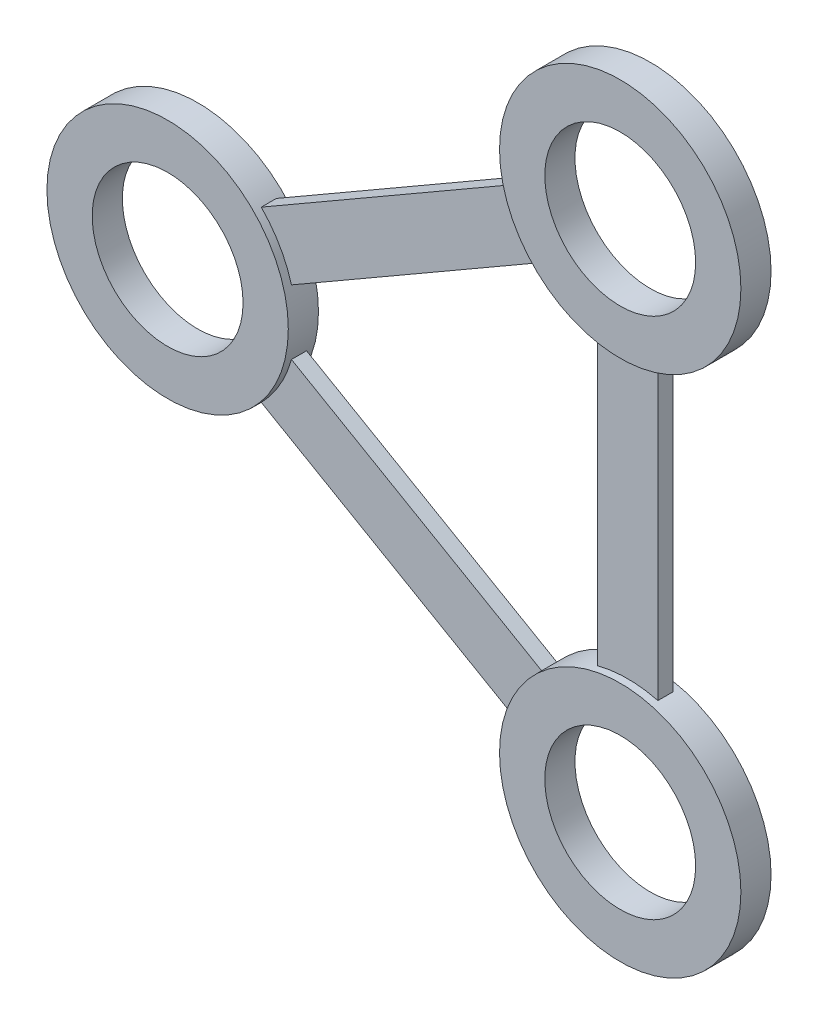
from build123d import *

# Parameters (mm, degrees)
BOSS_EXTRUDE1_DEPTH   = 2.5
BOSS_EXTRUDE1_2_DEPTH = 2.5
BOSS_EXTRUDE1_3_DEPTH = 2.5
SKETCH1_3_R           = 40
SKETCH1_3_R_2         = 25
BOSS_EXTRUDE2_DEPTH   = 5


with BuildPart() as part:
    # Sketch1 → Boss-Extrude1 (new, symmetric)
    with BuildSketch(Plane.XY):
        with BuildLine():
            ThreePointArc((80.86569638, 47.872706916), (70.86569638, 46.602540378), (60.86569638, 47.872706916))
            Line((60.86569638, 47.872706916), (60.86569638, -47.870166538))
            ThreePointArc((60.86569638, -47.870166538), (70.86569638, -46.6), (80.86569638, -47.870166538))
            Line((80.86569638, -47.870166538), (80.86569638, 47.872706916))
        make_face()
    extrude(amount=BOSS_EXTRUDE1_DEPTH, both=True)



with BuildPart() as body_2:
    # Sketch1 → Boss-Extrude1 2 (new, symmetric)
    with BuildSketch(Plane.XY):
        with BuildLine():
            Line((-40.593283957, 10.704662693), (42.324676718, 58.57736961))
            ThreePointArc((42.324676718, 58.57736961), (36.224680229, 66.602540378), (32.324676718, 75.897877685))
            Line((32.324676718, 75.897877685), (-50.593283957, 28.025170769))
            ThreePointArc((-50.593283957, 28.025170769), (-44.493287469, 20), (-40.593283957, 10.704662693))
        make_face()
    extrude(amount=BOSS_EXTRUDE1_2_DEPTH, both=True)


with BuildPart() as body_3:
    # Sketch1 → Boss-Extrude1 3 (new, symmetric)
    with BuildSketch(Plane.XY):
        with BuildLine():
            ThreePointArc((32.324540751, -75.895826853), (36.224426192, -66.600440011), (42.324320743, -58.575191763))
            Line((42.324320743, -58.575191763), (-40.593147991, -10.704173147))
            ThreePointArc((-40.593147991, -10.704173147), (-44.493033432, -19.999559989), (-50.592927983, -28.024808237))
            Line((-50.592927983, -28.024808237), (32.324540751, -75.895826853))
        make_face()
    extrude(amount=BOSS_EXTRUDE1_3_DEPTH, both=True)


with BuildPart() as part_1:
    add(part.part)

    add(body_2.part)  # Boss-Extrude2 merges body 2

    add(body_3.part)  # Boss-Extrude2 merges body 3
    # Sketch1<3> → Boss-Extrude2 (add, symmetric)
    # profile 1 of 3: a face of its own
    with BuildSketch(Plane.XY):
        with Locations((70.86569638, 86.602540378)):
            Circle(SKETCH1_3_R)
        with Locations((70.86569638, 86.602540378)):
            Circle(SKETCH1_3_R_2, mode=Mode.SUBTRACT)
    # profile 2 of 3: a face of its own
    with BuildSketch(Plane.XY):
        with Locations((70.86569638, -86.6)):
            Circle(SKETCH1_3_R)
        with Locations((70.86569638, -86.6)):
            Circle(SKETCH1_3_R_2, mode=Mode.SUBTRACT)
    # profile 3 of 3: a face of its own
    with BuildSketch(Plane.XY):
        with Locations((-79.13430362, 0)):
            Circle(SKETCH1_3_R)
        with Locations((-79.13430362, 0)):
            Circle(SKETCH1_3_R_2, mode=Mode.SUBTRACT)
    extrude(amount=BOSS_EXTRUDE2_DEPTH, both=True)


solid = part_1.part
